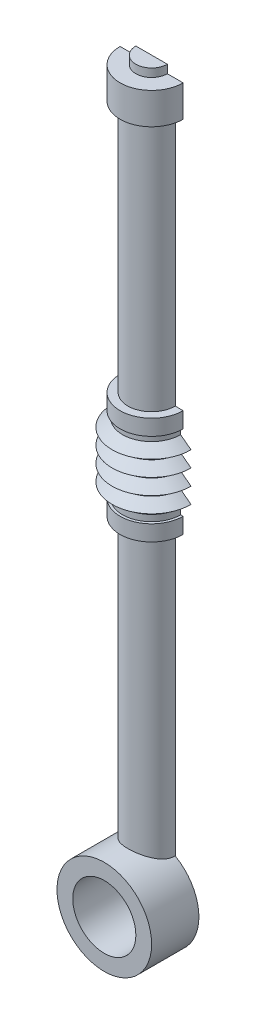
from build123d import *

# Parameters (mm, degrees)
BOSS_EXTRUDE1_DEPTH                  = 4.7625
BOSS_EXTRUDE1_DEPTH_BACK             = 2.38125
SKETCH1_R                            = 4.7625
SKETCH1_R_2                          = 3.175
SKETCH2_R                            = 2.38125
BOSS_EXTRUDE2_DEPTH                  = 28.575
BOSS_EXTRUDE2_DIRECTION_2_REACH      = 13.666
BOSS_EXTRUDE2_DIRECTION_2_END_RADIUS = 4.7625
SKETCH3_W                            = 3.175
SKETCH3_H                            = 1.5875
BOSS_EXTRUDE3_START                  = 25.4
SKETCH4_R                            = 2.38125
BOSS_EXTRUDE3_DEPTH                  = 25.4
SKETCH5_R                            = 3.175
BOSS_EXTRUDE4_DEPTH                  = 3.175
SKETCH6_R                            = 1.5875
BOSS_EXTRUDE5_DEPTH                  = 0.83185
SKETCH7_W                            = 15.534712676
SKETCH7_H                            = 81.822586025
CUT_EXTRUDE1_DEPTH                   = 74.056725452


with BuildPart() as part:
    # Sketch1 → Boss-Extrude1 (new, two sides: drawn at the far end of the back side and taken through both)
    with BuildSketch(Plane.XY.offset(-BOSS_EXTRUDE1_DEPTH_BACK)):
        Circle(SKETCH1_R)
        Circle(SKETCH1_R_2, mode=Mode.SUBTRACT)
    extrude(amount=BOSS_EXTRUDE1_DEPTH + BOSS_EXTRUDE1_DEPTH_BACK)

    # Sketch2 → Boss-Extrude2 (add)
    with BuildSketch(Plane(origin=(0, 4.7625, 0), x_dir=(1, 0, 0), z_dir=(0, 1, 0))):
        with Locations(Location((0, 0, 0), (0, 0, 90.000000028))):
            Circle(SKETCH2_R)
    extrude(amount=BOSS_EXTRUDE2_DEPTH)

    # Boss-Extrude2 direction 2: up to this cylinder (the profile starts outside it)
    boss_extrude2_direction_2_end = Plane(origin=(0, 0, 0), z_dir=(0, 0, 1)) * Cylinder(BOSS_EXTRUDE2_DIRECTION_2_END_RADIUS, 37.857, mode=Mode.PRIVATE)
    # Sketch2 → Boss-Extrude2 direction 2 (add, up to the surface)
    with BuildSketch(Plane(origin=(0, 4.7625, 0), x_dir=(1, 0, 0), z_dir=(0, 1, 0)), mode=Mode.PRIVATE) as boss_extrude2_direction_2_sk1:
        with Locations(Location((0, 0, 0), (0, 0, 90.000000028))):
            Circle(SKETCH2_R)
    boss_extrude2_direction_2_tool1 = extrude(boss_extrude2_direction_2_sk1.sketch, amount=-BOSS_EXTRUDE2_DIRECTION_2_REACH, mode=Mode.PRIVATE) - boss_extrude2_direction_2_end
    add(boss_extrude2_direction_2_tool1.solids().sort_by_distance((0, 4.7625, 0))[0])
    add(boss_extrude2_direction_2_tool1.solids().sort_by_distance((0, 4.7625, 0))[1])

    # Sketch3 → Revolve1 (revolve)
    with BuildSketch(Plane(origin=(0, 0, 0), x_dir=(0, 0, -1), z_dir=(1, 0, 0)), mode=Mode.PRIVATE) as revolve1_sk:
        with Locations((-1.5875, 33.3375)):
            Rectangle(SKETCH3_W, SKETCH3_H)
        Polygon((-2.921, 34.76625), (-2.921, 34.13125), (0, 34.13125), (0, 43.33875), (-3.175, 43.33875), (-3.175, 41.75125), (-2.921, 41.75125), (-2.921, 41.11625), (-3.96875, 40.3225), (-2.921, 39.52875), (-3.96875, 38.735), (-2.921, 37.94125), (-3.96875, 37.1475), (-2.921, 36.35375), (-3.96875, 35.56), align=None)
    revolve(revolve1_sk.sketch.rotate(Axis((0, 32.54375, 0), (0, 1, 0)), 180), axis=Axis((0, 32.54375, 0), (0, 1, 0)))

    # Sketch4 → Boss-Extrude3 (add)
    with BuildSketch(Plane(origin=(0, 43.33875, 0), x_dir=(1, 0, 0), z_dir=(0, 1, 0)).offset(BOSS_EXTRUDE3_START)):
        with Locations(Location((0, 0, 0), (0, 0, 90))):
            Circle(SKETCH4_R)
    extrude(amount=-BOSS_EXTRUDE3_DEPTH)

    # Sketch5 → Boss-Extrude4 (add)
    with BuildSketch(Plane(origin=(0, 68.73875, 0), x_dir=(1, 0, 0), z_dir=(0, 1, 0))):
        with Locations(Location((0, 0, 0), (0, 0, 90))):
            Circle(SKETCH5_R)
    extrude(amount=BOSS_EXTRUDE4_DEPTH)

    # Sketch6 → Boss-Extrude5 (add)
    with BuildSketch(Plane(origin=(0, 71.91375, 0), x_dir=(1, 0, 0), z_dir=(0, 1, 0))):
        with Locations(Location((0, 0, 0), (0, 0, 270))):
            Circle(SKETCH6_R)
    extrude(amount=BOSS_EXTRUDE5_DEPTH)

    # Sketch7 → Cut-Extrude1 (cut, through all)
    with BuildSketch(Plane.XY):
        with Locations((0.627177841, 34.425750044)):
            Rectangle(SKETCH7_W, SKETCH7_H)
    extrude(amount=-CUT_EXTRUDE1_DEPTH, mode=Mode.SUBTRACT)


solid = part.part
